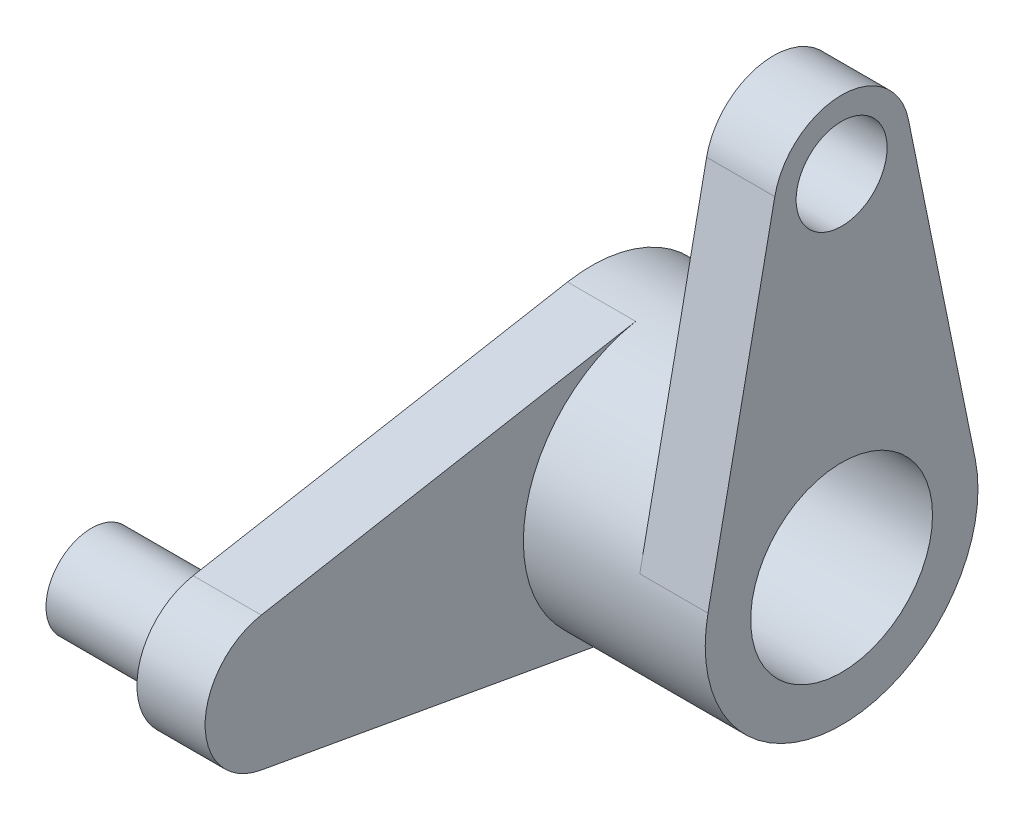
from build123d import *
from build123d.topology import SkipClean

# Parameters (mm, degrees)
BOSS_EXTRUDE1_DEPTH     = 15
SKETCH2_R               = 30
BOSS_EXTRUDE2_DEPTH     = 25
SKETCH3_R               = 20
SKETCH3_R_2             = 10
BOSS_EXTRUDE3_DEPTH     = 15
CUT_EXTRUDE1_DEPTH      = 146.344418537
CUT_EXTRUDE1_DEPTH_BACK = 146.344418537
SKETCH4_R               = 20
SKETCH5_R               = 10
BOSS_EXTRUDE4_DEPTH     = 25


with BuildPart() as part:
    # Sketch1 → Boss-Extrude1 (new body)
    with BuildSketch(Plane.YZ):
        with BuildLine():
            Line((-14.764588704, 87.647058824), (-29.529177407, 5.294117647))
            ThreePointArc((-29.529177407, 5.294117647), (0, -30), (29.529177407, 5.294117647))
            Line((29.529177407, 5.294117647), (14.764588704, 87.647058824))
            ThreePointArc((14.764588704, 87.647058824), (0, 100), (-14.764588704, 87.647058824))
        make_face()
    extrude(amount=BOSS_EXTRUDE1_DEPTH)

    # Sketch2 → Boss-Extrude2 (add)
    with BuildSketch(Plane.YZ.offset(15)):
        with Locations(Location((0, 0, 0), (0, 0, 10.164248622))):
            Circle(SKETCH2_R)
    extrude(amount=BOSS_EXTRUDE2_DEPTH)

    # Sketch3 → Boss-Extrude3 (add)
    with SkipClean():  # the faces are left unmerged after this step: merging them gives an invalid solid
        with BuildSketch(Plane.YZ.offset(40)):
            with BuildLine():
                Line((6, 29.393876913), (78, 14.696938457))
                ThreePointArc((78, 14.696938457), (90, 0), (78, -14.696938457))
                Line((78, -14.696938457), (6, -29.393876913))
                ThreePointArc((6, -29.393876913), (-30, 0), (6, 29.393876913))
            make_face()
            with Locations(Location((0, 0, 0), (0, 0, 270))):
                Circle(SKETCH3_R, mode=Mode.SUBTRACT)
            with Locations(Location((75, 0, 0), (0, 0, 270))):
                Circle(SKETCH3_R_2, mode=Mode.SUBTRACT)
        extrude(amount=BOSS_EXTRUDE3_DEPTH)

    # Sketch4 → Cut-Extrude1 (cut, two sides: drawn at the far end of the back side and taken through both)
    with SkipClean():  # the faces are left unmerged after this step: merging them gives an invalid solid
        with BuildSketch(Plane.YZ.offset(55).offset(-CUT_EXTRUDE1_DEPTH_BACK)):
            with Locations(Location((0, 0, 0), (0, 0, 270))):
                Circle(SKETCH4_R)
        extrude(amount=CUT_EXTRUDE1_DEPTH + CUT_EXTRUDE1_DEPTH_BACK, mode=Mode.SUBTRACT)

    # Sketch5 → Boss-Extrude4 (add)
    with SkipClean():  # the faces are left unmerged after this step: merging them gives an invalid solid
        with BuildSketch(Plane(origin=(0, 0, 0), x_dir=(0, -1, 0), z_dir=(-1, 0, 0))):
            with Locations(Location((0, 85, 0), (0, 0, 270))):
                Circle(SKETCH5_R)
        extrude(amount=BOSS_EXTRUDE4_DEPTH)


solid = part.part
